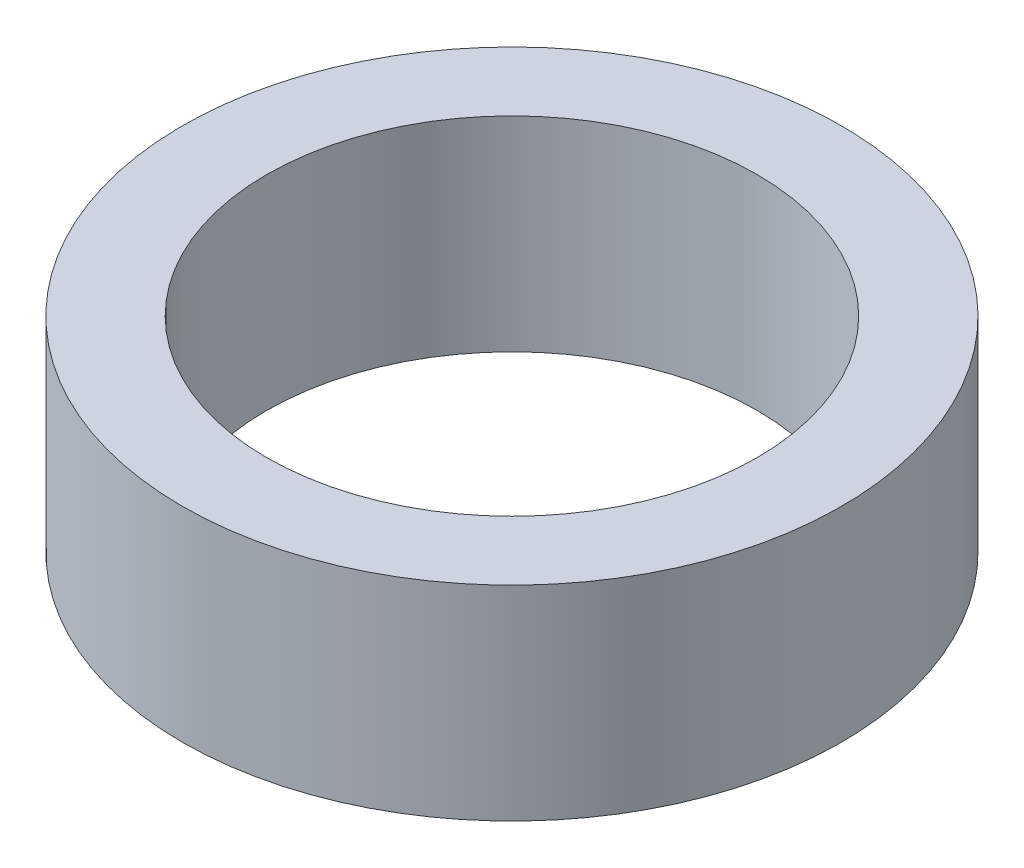
from build123d import *

# Parameters (mm, degrees)
SKETCH1_R           = 12.7
SKETCH1_R_2         = 9.4488
BOSS_EXTRUDE1_DEPTH = 7.874


with BuildPart() as part:
    # Sketch1 → Boss-Extrude1 (new body)
    with BuildSketch(Plane(origin=(0, 0, 0), x_dir=(1, 0, 0), z_dir=(0, 1, 0))):
        with Locations(Location((0, 0, 0), (0, 0, 270))):
            Circle(SKETCH1_R)
        with Locations(Location((0, 0, 0), (0, 0, 270))):
            Circle(SKETCH1_R_2, mode=Mode.SUBTRACT)
    extrude(amount=BOSS_EXTRUDE1_DEPTH)


solid = part.part
